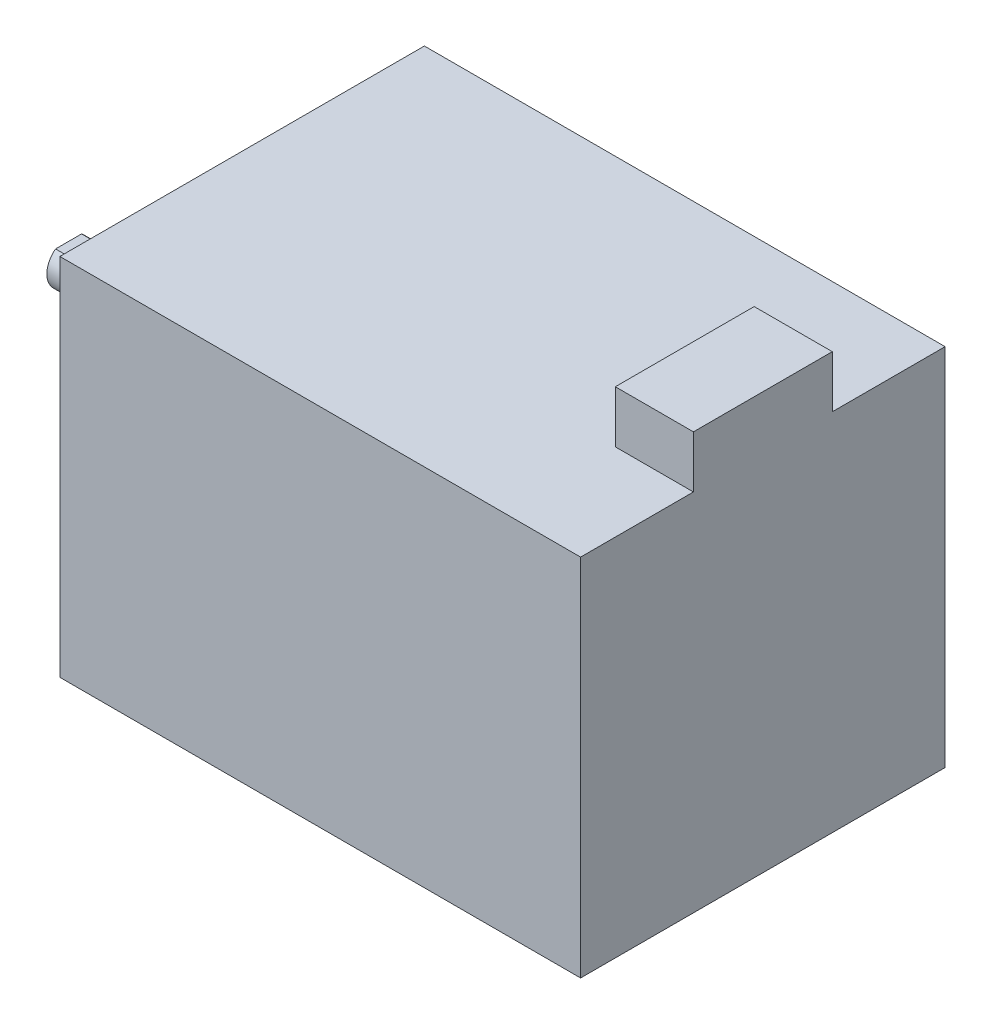
from build123d import *

# Parameters (mm, degrees)
SKETCH_2_W          = 42
SKETCH_2_H          = 42
SKETCH_2_R          = 1.5
EXTRUDE_1_DEPTH     = 60
EXTRUDE_2_DEPTH     = 20
SKETCH_2_4_W        = 16
SKETCH_2_4_H        = 6
EXTRUDE_3_DEPTH     = 60
SKETCH_2_5_W        = 16
SKETCH_2_5_H        = 6
CUT_EXTRUDE_1_DEPTH = 51
SKETCH_2_6_R        = 1.5
EXTRUDE_4_DEPTH     = 60
SKETCH_2_7_R        = 1.5
CUT_EXTRUDE_2_DEPTH = 10


with BuildPart() as part:
    # 草图2 → 凸台-拉伸1 (new body)
    with BuildSketch(Plane(origin=(0, 0, 0), x_dir=(0, 0, -1), z_dir=(1, 0, 0))):
        Rectangle(SKETCH_2_W, SKETCH_2_H)
        with Locations((-15.5, -15.5)):
            Circle(SKETCH_2_R, mode=Mode.SUBTRACT)
        with Locations((15.5, -15.5)):
            Circle(SKETCH_2_R, mode=Mode.SUBTRACT)
        with Locations((-15.5, 15.5)):
            Circle(SKETCH_2_R, mode=Mode.SUBTRACT)
        with Locations((15.5, 15.5)):
            Circle(SKETCH_2_R, mode=Mode.SUBTRACT)
    extrude(amount=EXTRUDE_1_DEPTH)

    # 草图2<3> → 凸台-拉伸2 (add)
    with BuildSketch(Plane(origin=(0, 0, 0), x_dir=(0, 0, -1), z_dir=(1, 0, 0))):
        with BuildLine():
            Line((1.5, 2), (-1.5, 2))
            ThreePointArc((-1.5, 2), (0, -2.5), (1.5, 2))
        make_face()
    extrude(amount=-EXTRUDE_2_DEPTH)

    # 草图2<4> → 凸台-拉伸3 (add)
    with BuildSketch(Plane(origin=(0, 0, 0), x_dir=(0, 0, -1), z_dir=(1, 0, 0))):
        with Locations((0, 24)):
            Rectangle(SKETCH_2_4_W, SKETCH_2_4_H)
    extrude(amount=EXTRUDE_3_DEPTH)

    # 草图2<5> → 切除-拉伸1 (cut)
    with BuildSketch(Plane(origin=(0, 0, 0), x_dir=(0, 0, -1), z_dir=(1, 0, 0))):
        with Locations((0, 24)):
            Rectangle(SKETCH_2_5_W, SKETCH_2_5_H)
    extrude(amount=CUT_EXTRUDE_1_DEPTH, mode=Mode.SUBTRACT)

    # 草图2<6> → 凸台-拉伸4 (add)
    with BuildSketch(Plane(origin=(0, 0, 0), x_dir=(0, 0, -1), z_dir=(1, 0, 0))):
        with Locations((15.5, 15.5)):
            Circle(SKETCH_2_6_R)
        with Locations((15.5, -15.5)):
            Circle(SKETCH_2_6_R)
        with Locations((-15.5, -15.5)):
            Circle(SKETCH_2_6_R)
        with Locations((-15.5, 15.5)):
            Circle(SKETCH_2_6_R)
    extrude(amount=EXTRUDE_4_DEPTH)

    # 草图2<7> → 切除-拉伸2 (cut)
    with BuildSketch(Plane(origin=(0, 0, 0), x_dir=(0, 0, -1), z_dir=(1, 0, 0))):
        with Locations((15.5, 15.5)):
            Circle(SKETCH_2_7_R)
        with Locations((15.5, -15.5)):
            Circle(SKETCH_2_7_R)
        with Locations((-15.5, -15.5)):
            Circle(SKETCH_2_7_R)
        with Locations((-15.5, 15.5)):
            Circle(SKETCH_2_7_R)
    extrude(amount=CUT_EXTRUDE_2_DEPTH, mode=Mode.SUBTRACT)


solid = part.part
